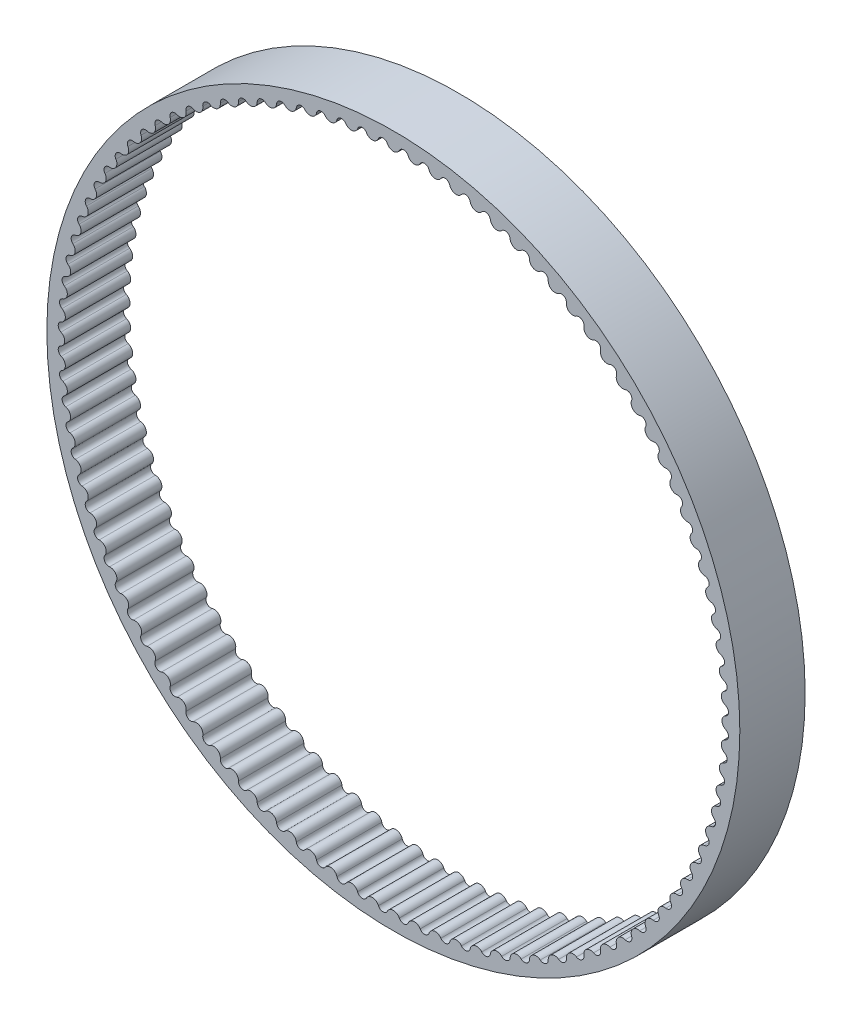
from build123d import *

# Parameters (mm, degrees)
SKETCH2_R           = 31.831015505
SKETCH2_R_2         = 30.191015505
BOSS_EXTRUDE1_DEPTH = 3
CUT_EXTRUDE1_DEPTH  = 46.115707865
CIRPATTERN3_COUNT   = 100


with BuildPart() as part:
    # Sketch2 → Boss-Extrude1 (new, symmetric)
    with BuildSketch(Plane.XY):
        Circle(SKETCH2_R)
        Circle(SKETCH2_R_2, mode=Mode.SUBTRACT)
    extrude(amount=BOSS_EXTRUDE1_DEPTH, both=True)

    # Sketch3 → Cut-Extrude1 (cut, symmetric)
    with BuildSketch(Plane.XY):
        with BuildLine():
            ThreePointArc((1.895709549, 30.131440432), (0.948322714, 30.176118061), (0, 30.191015505))
            ThreePointArc((0, 30.191015505), (0.322988817, 30.283542584), (0.547993333, 30.533054114))
            ThreePointArc((0.547993333, 30.533054114), (0.967483277, 30.785817063), (1.370274337, 30.507212892))
            ThreePointArc((1.370274337, 30.507212892), (1.5791679, 30.244065566), (1.895709549, 30.131440432))
        make_face()
    cut_extrude1 = extrude(amount=CUT_EXTRUDE1_DEPTH, both=True, mode=Mode.SUBTRACT)

    # CirPattern3: Cut-Extrude1 ×100 about axis
    cirpattern3_axis = Axis((0, 0, 3), (0, 0, -1))
    for i in range(1, CIRPATTERN3_COUNT):
        add(cut_extrude1.rotate(cirpattern3_axis, i * 360 / CIRPATTERN3_COUNT), mode=Mode.SUBTRACT)


solid = part.part
